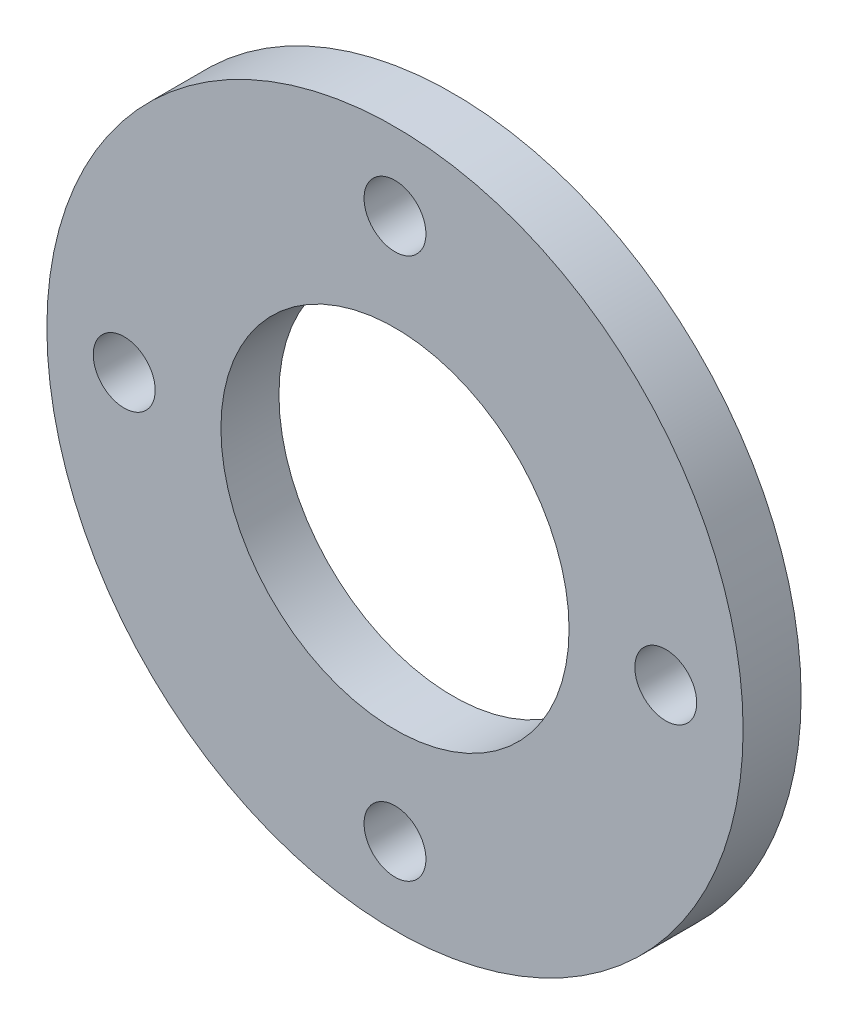
from build123d import *

# Parameters (mm, degrees)
MODEL_R         = 18
MODEL_R_2       = 9
MODEL_R_3       = 1.6
EXTRUDE_1_DEPTH = 3


with BuildPart() as part:
    # Model → 凸台-拉伸1 (new body)
    with BuildSketch(Plane.XY):
        Circle(MODEL_R)
        Circle(MODEL_R_2, mode=Mode.SUBTRACT)
        with Locations((0, 14)):
            Circle(MODEL_R_3, mode=Mode.SUBTRACT)
        with Locations((-14, 0)):
            Circle(MODEL_R_3, mode=Mode.SUBTRACT)
        with Locations((0, -14)):
            Circle(MODEL_R_3, mode=Mode.SUBTRACT)
        with Locations((14, 0)):
            Circle(MODEL_R_3, mode=Mode.SUBTRACT)
    extrude(amount=EXTRUDE_1_DEPTH)


solid = part.part
